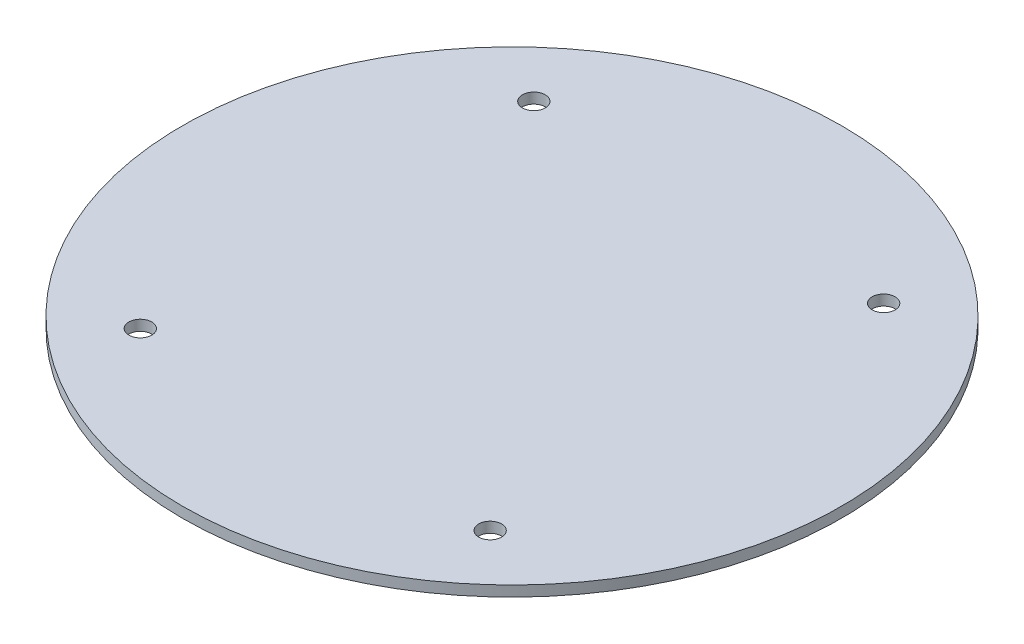
from build123d import *

# Parameters (mm, degrees)
SKETCH1_R      = 49.78
EXTRUDE1_DEPTH = 1.5875
SKETCH2_R      = 1.7272
EXTRUDE2_DEPTH = 10


with BuildPart() as part:
    # Sketch1 → Extrude1 (new body)
    with BuildSketch(Plane(origin=(0, 0, 0), x_dir=(1, 0, 0), z_dir=(0, 1, 0))):
        with Locations(Location((0, 0, 0), (0, 0, 270))):
            Circle(SKETCH1_R)
    extrude(amount=EXTRUDE1_DEPTH)

    # Sketch2 → Extrude2 (cut)
    with BuildSketch(Plane(origin=(0, 1.5875, 0), x_dir=(-1, 0, 0), z_dir=(0, 1, 0))):
        with Locations(Location((-26.42, -29.72, 0), (0, 0, 90))):
            Circle(SKETCH2_R)
        with Locations(Location((-26.42, 29.72, 0), (0, 0, 90))):
            Circle(SKETCH2_R)
    extrude2 = extrude(amount=-EXTRUDE2_DEPTH, mode=Mode.SUBTRACT)

    # Mirror1: Extrude2 across plane
    add(extrude2.mirror(Plane(origin=(0, 0, 0), x_dir=(0, 0, 1), z_dir=(1, 0, 0))), mode=Mode.SUBTRACT)


solid = part.part
